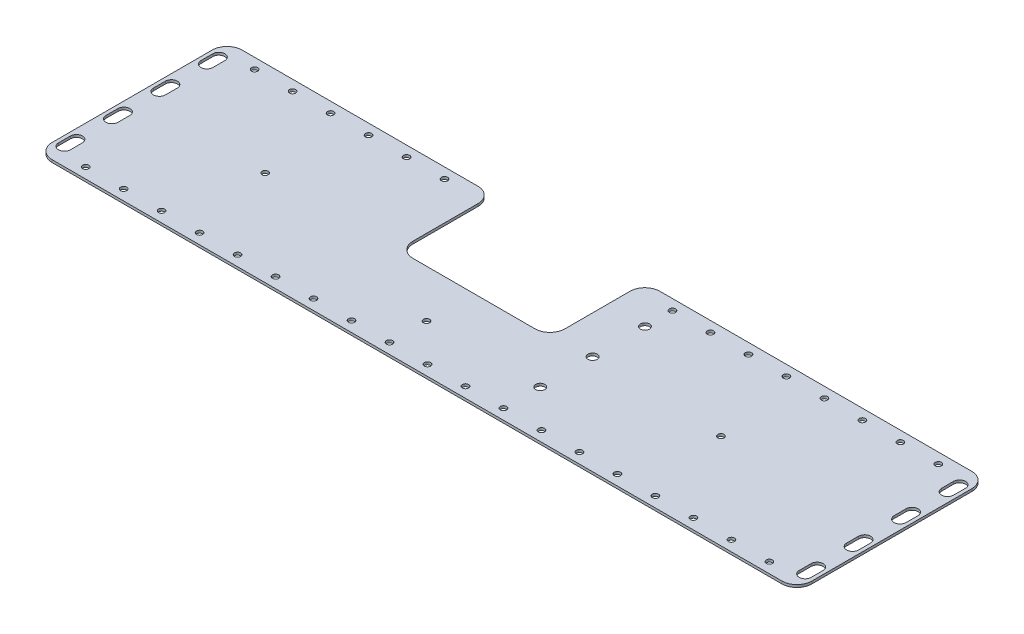
from build123d import *

# Parameters (mm, degrees)
SKETCH1_W               = 508
SKETCH1_H               = 127
BOSS_EXTRUDE1_DEPTH     = 0.85
CUT_EXTRUDE1_DEPTH      = 262.822726286
CUT_EXTRUDE1_DEPTH_BACK = 262.822726286
FILLET1_R               = 10
SKETCH3_W               = 101.6
SKETCH3_H               = 63.5
CUT_EXTRUDE2_DEPTH      = 262.822726286
FILLET2_R               = 10
SKETCH8_R               = 2.07
CUT_EXTRUDE3_DEPTH      = 1.7
SKETCH12_R              = 3.05
CUT_EXTRUDE4_DEPTH      = 262.822726286


with BuildPart() as part:
    # Sketch1 → Boss-Extrude1 (new, symmetric)
    with BuildSketch(Plane(origin=(0, 0, 0), x_dir=(1, 0, 0), z_dir=(0, 1, 0))):
        Rectangle(SKETCH1_W, SKETCH1_H)
    extrude(amount=BOSS_EXTRUDE1_DEPTH, both=True)

    # Sketch2 → Cut-Extrude1 (cut, two sides: drawn at the far end of the back side and taken through both)
    with BuildSketch(Plane(origin=(0, 0.85, 0), x_dir=(1, 0, 0), z_dir=(0, 1, 0)).offset(-CUT_EXTRUDE1_DEPTH_BACK)):
        with BuildLine():
            Line((251.65, -43.625), (251.65, -51.625))
            ThreePointArc((251.65, -51.625), (247.65, -55.625), (243.65, -51.625))
            Line((243.65, -51.625), (243.65, -43.625))
            ThreePointArc((243.65, -43.625), (247.65, -39.625), (251.65, -43.625))
        make_face()
        with BuildLine():
            Line((251.65, -19.875), (251.65, -11.875))
            ThreePointArc((251.65, -11.875), (247.65, -7.875), (243.65, -11.875))
            Line((243.65, -11.875), (243.65, -19.875))
            ThreePointArc((243.65, -19.875), (247.65, -23.875), (251.65, -19.875))
        make_face()
        with BuildLine():
            Line((251.65, 19.875), (251.65, 11.875))
            ThreePointArc((251.65, 11.875), (247.65, 7.875), (243.65, 11.875))
            Line((243.65, 11.875), (243.65, 19.875))
            ThreePointArc((243.65, 19.875), (247.65, 23.875), (251.65, 19.875))
        make_face()
        with BuildLine():
            Line((251.65, 43.625), (251.65, 51.625))
            ThreePointArc((251.65, 51.625), (247.65, 55.625), (243.65, 51.625))
            Line((243.65, 51.625), (243.65, 43.625))
            ThreePointArc((243.65, 43.625), (247.65, 39.625), (251.65, 43.625))
        make_face()
        with BuildLine():
            Line((-251.65, 43.625), (-251.65, 51.625))
            ThreePointArc((-251.65, 51.625), (-247.65, 55.625), (-243.65, 51.625))
            Line((-243.65, 51.625), (-243.65, 43.625))
            ThreePointArc((-243.65, 43.625), (-247.65, 39.625), (-251.65, 43.625))
        make_face()
        with BuildLine():
            Line((-251.65, 19.875), (-251.65, 11.875))
            ThreePointArc((-251.65, 11.875), (-247.65, 7.875), (-243.65, 11.875))
            Line((-243.65, 11.875), (-243.65, 19.875))
            ThreePointArc((-243.65, 19.875), (-247.65, 23.875), (-251.65, 19.875))
        make_face()
        with BuildLine():
            Line((-251.65, -19.875), (-251.65, -11.875))
            ThreePointArc((-251.65, -11.875), (-247.65, -7.875), (-243.65, -11.875))
            Line((-243.65, -11.875), (-243.65, -19.875))
            ThreePointArc((-243.65, -19.875), (-247.65, -23.875), (-251.65, -19.875))
        make_face()
        with BuildLine():
            Line((-251.65, -43.625), (-251.65, -51.625))
            ThreePointArc((-251.65, -51.625), (-247.65, -55.625), (-243.65, -51.625))
            Line((-243.65, -51.625), (-243.65, -43.625))
            ThreePointArc((-243.65, -43.625), (-247.65, -39.625), (-251.65, -43.625))
        make_face()
    extrude(amount=CUT_EXTRUDE1_DEPTH + CUT_EXTRUDE1_DEPTH_BACK, mode=Mode.SUBTRACT)

    # Fillet1
    fillet1_edges = [part.edges().sort_by_distance(p)[0] for p in [
        (-254, 0, -63.5),
        (254, 0, -63.5),
        (254, 0, 63.5),
        (-254, 0, 63.5),
    ]]
    fillet(fillet1_edges, radius=FILLET1_R)

    # Sketch3 → Cut-Extrude2 (cut, through all)
    with BuildSketch(Plane(origin=(0, 0.85, 0), x_dir=(1, 0, 0), z_dir=(0, 1, 0))):
        with Locations((-25.4, 31.75)):
            Rectangle(SKETCH3_W, SKETCH3_H)
    extrude(amount=-CUT_EXTRUDE2_DEPTH, mode=Mode.SUBTRACT)

    # Fillet2
    fillet2_edges = [part.edges().sort_by_distance(p)[0] for p in [
        (-76.2, 0, 0),
        (-76.2, 0, -63.5),
        (25.4, 0, -63.5),
        (25.4, 0, 0),
    ]]
    fillet(fillet2_edges, radius=FILLET2_R)

    # Sketch8 → Cut-Extrude3 (cut)
    with BuildSketch(Plane(origin=(0, 0.85, 0), x_dir=(1, 0, 0), z_dir=(0, 1, 0))):
        with Locations(Location((-165.1, 0, 0), (0, 0, 270))):
            Circle(SKETCH8_R)
        with Locations(Location((-25.4, -31.75, 0), (0, 0, 270))):
            Circle(SKETCH8_R)
        with Locations(Location((139.7, 0, 0), (0, 0, 270))):
            Circle(SKETCH8_R)
        with Locations(Location((-228.6, -56.5, 0), (0, 0, 270))):
            Circle(SKETCH8_R)
        with Locations(Location((-203.2, -56.5, 0), (0, 0, 270))):
            Circle(SKETCH8_R)
        with Locations(Location((-177.8, -56.5, 0), (0, 0, 270))):
            Circle(SKETCH8_R)
        with Locations(Location((-152.4, -56.5, 0), (0, 0, 270))):
            Circle(SKETCH8_R)
        with Locations(Location((-127, -56.5, 0), (0, 0, 270))):
            Circle(SKETCH8_R)
        with Locations(Location((-101.6, -56.5, 0), (0, 0, 270))):
            Circle(SKETCH8_R)
        with Locations(Location((-76.2, -56.5, 0), (0, 0, 270))):
            Circle(SKETCH8_R)
        with Locations(Location((-50.8, -56.5, 0), (0, 0, 270))):
            Circle(SKETCH8_R)
        with Locations(Location((-25.4, -56.5, 0), (0, 0, 270))):
            Circle(SKETCH8_R)
        with Locations(Location((0, -56.5, 0), (0, 0, 270))):
            Circle(SKETCH8_R)
        with Locations(Location((25.4, -56.5, 0), (0, 0, 270))):
            Circle(SKETCH8_R)
        with Locations(Location((50.8, -56.5, 0), (0, 0, 270))):
            Circle(SKETCH8_R)
        with Locations(Location((76.2, -56.5, 0), (0, 0, 270))):
            Circle(SKETCH8_R)
        with Locations(Location((101.6, -56.5, 0), (0, 0, 270))):
            Circle(SKETCH8_R)
        with Locations(Location((127, -56.5, 0), (0, 0, 270))):
            Circle(SKETCH8_R)
        with Locations(Location((152.4, -56.5, 0), (0, 0, 270))):
            Circle(SKETCH8_R)
        with Locations(Location((177.8, -56.5, 0), (0, 0, 270))):
            Circle(SKETCH8_R)
        with Locations(Location((203.2, -56.5, 0), (0, 0, 270))):
            Circle(SKETCH8_R)
        with Locations(Location((228.6, -56.5, 0), (0, 0, 270))):
            Circle(SKETCH8_R)
        with Locations(Location((-228.6, 56.5, 0), (0, 0, 270))):
            Circle(SKETCH8_R)
        with Locations(Location((-203.2, 56.5, 0), (0, 0, 270))):
            Circle(SKETCH8_R)
        with Locations(Location((-177.8, 56.5, 0), (0, 0, 270))):
            Circle(SKETCH8_R)
        with Locations(Location((-152.4, 56.5, 0), (0, 0, 270))):
            Circle(SKETCH8_R)
        with Locations(Location((-127, 56.5, 0), (0, 0, 270))):
            Circle(SKETCH8_R)
        with Locations(Location((-101.6, 56.5, 0), (0, 0, 270))):
            Circle(SKETCH8_R)
        with Locations(Location((50.8, 56.5, 0), (0, 0, 270))):
            Circle(SKETCH8_R)
        with Locations(Location((76.2, 56.5, 0), (0, 0, 270))):
            Circle(SKETCH8_R)
        with Locations(Location((101.6, 56.5, 0), (0, 0, 270))):
            Circle(SKETCH8_R)
        with Locations(Location((127, 56.5, 0), (0, 0, 270))):
            Circle(SKETCH8_R)
        with Locations(Location((152.4, 56.5, 0), (0, 0, 270))):
            Circle(SKETCH8_R)
        with Locations(Location((177.8, 56.5, 0), (0, 0, 270))):
            Circle(SKETCH8_R)
        with Locations(Location((203.2, 56.5, 0), (0, 0, 270))):
            Circle(SKETCH8_R)
        with Locations(Location((228.6, 56.5, 0), (0, 0, 270))):
            Circle(SKETCH8_R)
    extrude(amount=-CUT_EXTRUDE3_DEPTH, mode=Mode.SUBTRACT)

    # Sketch12 → Cut-Extrude4 (cut, through all)
    with BuildSketch(Plane(origin=(0, 0.85, 0), x_dir=(1, 0, 0), z_dir=(0, 1, 0))):
        with Locations(Location((50.8, 38.1, 0), (0, 0, 270))):
            Circle(SKETCH12_R)
        with Locations(Location((50.8, 3.1, 0), (0, 0, 270))):
            Circle(SKETCH12_R)
        with Locations(Location((50.8, -31.9, 0), (0, 0, 270))):
            Circle(SKETCH12_R)
    extrude(amount=-CUT_EXTRUDE4_DEPTH, mode=Mode.SUBTRACT)


solid = part.part
